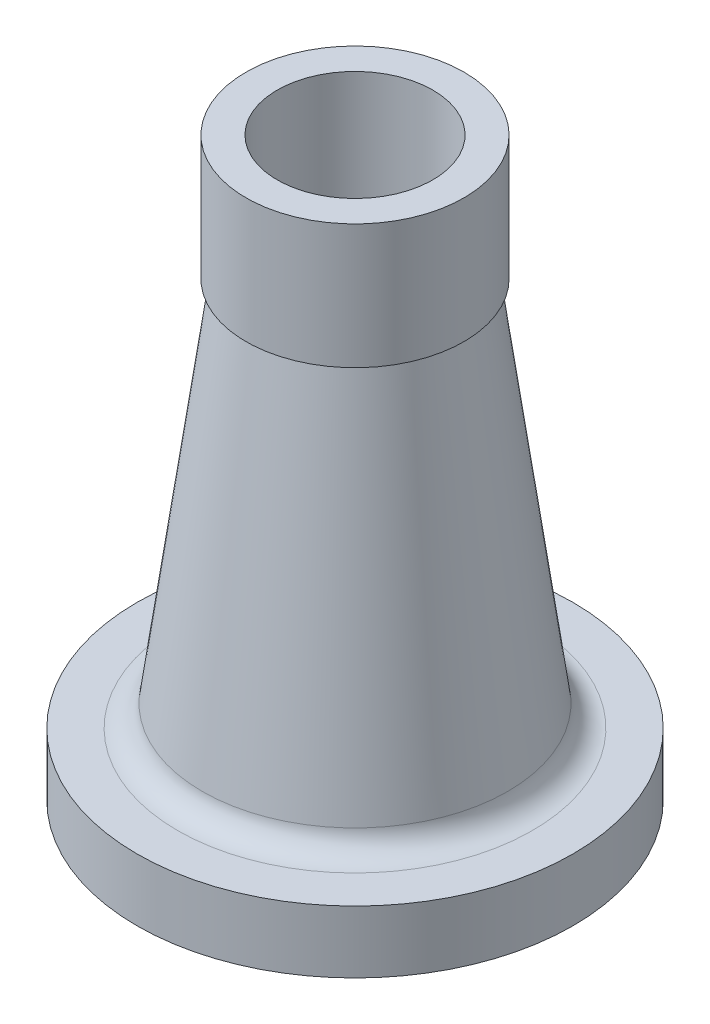
from build123d import *

# Parameters (mm, degrees)
FILLET1_R = 8


with BuildPart() as part:
    # Sketch1 → Revolve1 (revolve)
    with BuildSketch(Plane.XY, mode=Mode.PRIVATE) as revolve1_sk:
        Polygon((50, 0), (70, 0), (70, 20), (50, 20), (33, 145), (35, 145), (35, 185), (25, 185), (25, 129.61723322), (42.219943718, 3), (50, 3), align=None)
    revolve(revolve1_sk.sketch.rotate(Axis((0, 0, 0), (0, 1, 0)), 90), axis=Axis((0, 0, 0), (0, 1, 0)))

    # Fillet1
    fillet1_edges = [part.edges().sort_by_distance(p)[0] for p in [
        (0, 20, 50),
    ]]
    fillet(fillet1_edges, radius=FILLET1_R)


solid = part.part
